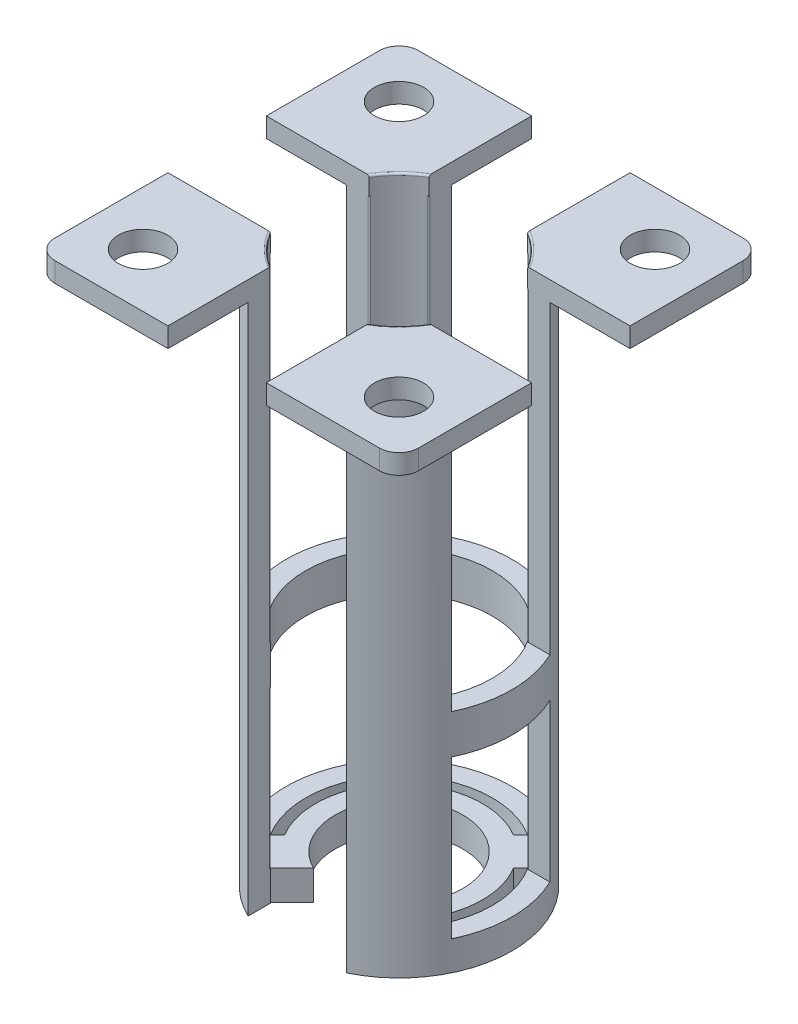
from build123d import *

# Parameters (mm, degrees)
SKETCH5_W           = 46.95000008
SKETCH5_H           = 46.95000008
SKETCH5_R           = 14.58500004
SKETCH5_R_2         = 12.04500004
BOSS_EXTRUDE2_DEPTH = 71.150000194
CUT_EXTRUDE2_REACH  = 83.054
CUT_EXTRUDE2_START  = -2.54
SKETCH5_5_W         = 46.95000008
SKETCH5_5_H         = 46.95000008
SKETCH5_5_R         = 14.58500004
SKETCH10_W          = 12.7
SKETCH10_H          = 68.610000194
CUT_EXTRUDE3_DEPTH  = 89.417762141
CIRPATTERN2_COUNT   = 2
CIRPATTERN2_ANGLE   = 90
CUT_EXTRUDE4_REACH  = 90.418
SKETCH12_W          = 12.7
SKETCH12_H          = 2.54
FILLET6_R           = 0.254
FILLET10_R          = 2.54
CUT_EXTRUDE5_REACH  = 78.22
SKETCH13_R          = 3.175
SKETCH23_R          = 14.58500004
SKETCH23_R_2        = 12.04500004
BOSS_EXTRUDE3_DEPTH = 3.81
BOSS_EXTRUDE4_DEPTH = 3.81
CUT_EXTRUDE7_DEPTH  = 76.078804586
BOSS_EXTRUDE6_DEPTH = 5.08
CIRPATTERN6_COUNT   = 4


with BuildPart() as part:
    # Sketch5 → Boss-Extrude2 (new body)
    # profile 1 of 2: a face of its own
    with BuildSketch(Plane(origin=(0, 0, 0), x_dir=(1, 0, 0), z_dir=(0, 1, 0))):
        Rectangle(SKETCH5_W, SKETCH5_H)
        Circle(SKETCH5_R, mode=Mode.SUBTRACT)
    # profile 2 of 2: a face of its own
    with BuildSketch(Plane(origin=(0, 0, 0), x_dir=(1, 0, 0), z_dir=(0, 1, 0))):
        Circle(SKETCH5_R)
        with Locations(Location((0, 0, 0), (0, 0, 270))):
            Circle(SKETCH5_R_2, mode=Mode.SUBTRACT)
    extrude(amount=-BOSS_EXTRUDE2_DEPTH)

    # Sketch5<5> → Cut-Extrude2 (cut, up to next)
    with BuildSketch(Plane(origin=(0, 0, 0), x_dir=(1, 0, 0), z_dir=(0, 1, 0)).offset(CUT_EXTRUDE2_START), mode=Mode.PRIVATE) as cut_extrude2_sk1:
        Rectangle(SKETCH5_5_W, SKETCH5_5_H)
        with Locations(Location((0, 0, 0), (0, 0, 270))):
            Circle(SKETCH5_5_R, mode=Mode.SUBTRACT)
    cut_extrude2_tool1 = extrude(cut_extrude2_sk1.sketch, amount=-CUT_EXTRUDE2_REACH, mode=Mode.PRIVATE) & part.part
    add(cut_extrude2_tool1.solids().sort_by_distance((0, -2.54, 22.811027))[0], mode=Mode.SUBTRACT)

    # Sketch10 → Cut-Extrude3 (cut, through all)
    with BuildSketch(Plane(origin=(23.47500004, 0, 0), x_dir=(0, 0, -1), z_dir=(1, 0, 0))):
        with Locations((0, -36.845000097)):
            Rectangle(SKETCH10_W, SKETCH10_H)
    cut_extrude3 = extrude(amount=-CUT_EXTRUDE3_DEPTH, mode=Mode.SUBTRACT)

    # CirPattern2: Cut-Extrude3 ×2 about axis
    cirpattern2_axis = Axis((0, 0, 0), (0, 1, 0))
    for i in range(1, CIRPATTERN2_COUNT):
        add(cut_extrude3.rotate(cirpattern2_axis, i * CIRPATTERN2_ANGLE / (CIRPATTERN2_COUNT - 1)), mode=Mode.SUBTRACT)

    # Sketch12 → Cut-Extrude4 (cut, up to next)
    with BuildSketch(Plane.XY.offset(23.47500004), mode=Mode.PRIVATE) as cut_extrude4_sk1:
        with Locations((0, -1.27)):
            Rectangle(SKETCH12_W, SKETCH12_H)
    cut_extrude4_tool1 = extrude(cut_extrude4_sk1.sketch, amount=-CUT_EXTRUDE4_REACH, mode=Mode.PRIVATE) & part.part
    cut_extrude4 = cut_extrude4_tool1.solids().sort_by_distance((0, -1.27, 23.475))[0]
    add(cut_extrude4, mode=Mode.SUBTRACT)

    # Fillet6
    fillet6_edges = [part.edges().sort_by_distance(p)[0] for p in [
        (8.517101208, -71.150000194, -8.517101208),
        (-8.517101208, -71.150000194, 8.517101208),
        (-12.04500004, -2.54, 0),
        (12.04500004, -2.54, 0),
        (-10.235210108, -36.845000097, -6.35),
        (10.235210108, -36.845000097, -6.35),
        (10.235210108, -36.845000097, 6.35),
        (-10.235210108, -36.845000097, 6.35),
        (0, 0, -12.04500004),
        (-8.517101208, -71.150000194, -8.517101208),
        (8.517101208, -71.150000194, 8.517101208),
        (0, -2.54, -12.04500004),
        (-6.35, -35.575000097, 10.235210108),
        (-6.35, -36.845000097, -10.235210108),
        (6.35, -36.845000097, -10.235210108),
        (6.35, -35.575000097, 10.235210108),
    ]]
    fillet(fillet6_edges, radius=FILLET6_R)

    # Fillet10
    fillet10_edges = [part.edges().sort_by_distance(p)[0] for p in [
        (23.47500004, -1.27, 23.47500004),
        (23.47500004, -1.27, -23.47500004),
        (-23.47500004, -1.27, -23.47500004),
        (-23.47500004, -1.27, 23.47500004),
    ]]
    fillet(fillet10_edges, radius=FILLET10_R)

    # Sketch13 → Cut-Extrude5 (cut, up to next)
    with BuildSketch(Plane.XZ.offset(2.54), mode=Mode.PRIVATE) as cut_extrude5_sk1:
        with Locations(Location((-16.522101848, 16.522101848, 0), (0, 0, 270))):
            Circle(SKETCH13_R)
    cut_extrude5_tool1 = extrude(cut_extrude5_sk1.sketch, amount=-CUT_EXTRUDE5_REACH, mode=Mode.PRIVATE) & part.part
    # Sketch13 → Cut-Extrude5 (cut, up to next)
    with BuildSketch(Plane.XZ.offset(2.54), mode=Mode.PRIVATE) as cut_extrude5_sk2:
        with Locations(Location((16.522101848, 16.522101848, 0), (0, 0, 90))):
            Circle(SKETCH13_R)
    cut_extrude5_tool2 = extrude(cut_extrude5_sk2.sketch, amount=-CUT_EXTRUDE5_REACH, mode=Mode.PRIVATE) & part.part
    # Sketch13 → Cut-Extrude5 (cut, up to next)
    with BuildSketch(Plane.XZ.offset(2.54), mode=Mode.PRIVATE) as cut_extrude5_sk3:
        with Locations(Location((16.522101848, -16.522101848, 0), (0, 0, 270))):
            Circle(SKETCH13_R)
    cut_extrude5_tool3 = extrude(cut_extrude5_sk3.sketch, amount=-CUT_EXTRUDE5_REACH, mode=Mode.PRIVATE) & part.part
    # Sketch13 → Cut-Extrude5 (cut, up to next)
    with BuildSketch(Plane.XZ.offset(2.54), mode=Mode.PRIVATE) as cut_extrude5_sk4:
        with Locations(Location((-16.522101848, -16.522101848, 0), (0, 0, 90))):
            Circle(SKETCH13_R)
    cut_extrude5_tool4 = extrude(cut_extrude5_sk4.sketch, amount=-CUT_EXTRUDE5_REACH, mode=Mode.PRIVATE) & part.part
    add(cut_extrude5_tool1.solids().sort_by_distance((-16.522102, -2.54, 16.522102))[0], mode=Mode.SUBTRACT)
    add(cut_extrude5_tool2.solids().sort_by_distance((16.522102, -2.54, 16.522102))[0], mode=Mode.SUBTRACT)
    add(cut_extrude5_tool3.solids().sort_by_distance((16.522102, -2.54, -16.522102))[0], mode=Mode.SUBTRACT)
    add(cut_extrude5_tool4.solids().sort_by_distance((-16.522102, -2.54, -16.522102))[0], mode=Mode.SUBTRACT)

    # Sketch23 → Boss-Extrude3 (add)
    with BuildSketch(Plane(origin=(0, -67.340000194, 0), x_dir=(-1, 0, 0), z_dir=(0, -1, 0))):
        with Locations(Location((0, 0, 0), (0, 0, 270))):
            Circle(SKETCH23_R)
        with Locations(Location((0, 0, 0), (0, 0, 270))):
            Circle(SKETCH23_R_2, mode=Mode.SUBTRACT)
    extrude(amount=BOSS_EXTRUDE3_DEPTH)

    # Sketch26 → Boss-Extrude4 (add)
    with BuildSketch(Plane(origin=(0, -67.340000194, 0), x_dir=(-1, 0, 0), z_dir=(0, -1, 0))):
        with BuildLine():
            Line((-5.545009846, 9.238695345), (-6.467613628, 10.161299126))
            ThreePointArc((-6.467613628, 10.161299126), (-8.517101208, 8.517101208), (-10.161299126, 6.467613628))
            Line((-10.161299126, 6.467613628), (-9.238695345, 5.545009846))
            ThreePointArc((-9.238695345, 5.545009846), (-7.619075596, 7.619075596), (-5.545009846, 9.238695345))
        make_face()
        with BuildLine():
            ThreePointArc((6.467613628, -10.161299126), (8.517101208, -8.517101208), (10.161299126, -6.467613628))
            Line((10.161299126, -6.467613628), (9.238695345, -5.545009846))
            ThreePointArc((9.238695345, -5.545009846), (7.619075596, -7.619075596), (5.545009846, -9.238695345))
            Line((5.545009846, -9.238695345), (6.467613628, -10.161299126))
        make_face()
        with BuildLine():
            ThreePointArc((10.161299126, 6.467613628), (8.517101208, 8.517101208), (6.467613628, 10.161299126))
            Line((6.467613628, 10.161299126), (5.545009846, 9.238695345))
            ThreePointArc((5.545009846, 9.238695345), (7.619075596, 7.619075596), (9.238695345, 5.545009846))
            Line((9.238695345, 5.545009846), (10.161299126, 6.467613628))
        make_face()
        with BuildLine():
            Line((-9.238695345, -5.545009846), (-10.161299126, -6.467613628))
            ThreePointArc((-10.161299126, -6.467613628), (-8.517101208, -8.517101208), (-6.467613628, -10.161299126))
            Line((-6.467613628, -10.161299126), (-5.545009846, -9.238695345))
            ThreePointArc((-5.545009846, -9.238695345), (-7.619075596, -7.619075596), (-9.238695345, -5.545009846))
        make_face()
        with BuildLine():
            Line((-3.675546651, 7.36923215), (-5.545009846, 9.238695345))
            ThreePointArc((-5.545009846, 9.238695345), (-7.619075596, 7.619075596), (-9.238695345, 5.545009846))
            Line((-9.238695345, 5.545009846), (-7.36923215, 3.675546651))
            ThreePointArc((-7.36923215, 3.675546651), (-5.823024371, 5.823024371), (-3.675546651, 7.36923215))
        make_face()
        with BuildLine():
            Line((9.238695345, -5.545009846), (7.36923215, -3.675546651))
            ThreePointArc((7.36923215, -3.675546651), (5.823024371, -5.823024371), (3.675546651, -7.36923215))
            Line((3.675546651, -7.36923215), (5.545009846, -9.238695345))
            ThreePointArc((5.545009846, -9.238695345), (7.619075596, -7.619075596), (9.238695345, -5.545009846))
        make_face()
        with BuildLine():
            ThreePointArc((9.238695345, 5.545009846), (7.619075596, 7.619075596), (5.545009846, 9.238695345))
            Line((5.545009846, 9.238695345), (3.675546651, 7.36923215))
            ThreePointArc((3.675546651, 7.36923215), (5.823024371, 5.823024371), (7.36923215, 3.675546651))
            Line((7.36923215, 3.675546651), (9.238695345, 5.545009846))
        make_face()
        with BuildLine():
            Line((-7.36923215, -3.675546651), (-9.238695345, -5.545009846))
            ThreePointArc((-9.238695345, -5.545009846), (-7.619075596, -7.619075596), (-5.545009846, -9.238695345))
            Line((-5.545009846, -9.238695345), (-3.675546651, -7.36923215))
            ThreePointArc((-3.675546651, -7.36923215), (-5.823024371, -5.823024371), (-7.36923215, -3.675546651))
        make_face()
        with BuildLine():
            Line((-7.36923215, 3.675546651), (-9.238695345, 5.545009846))
            ThreePointArc((-9.238695345, 5.545009846), (-10.77500004, 0), (-9.238695345, -5.545009846))
            Line((-9.238695345, -5.545009846), (-7.36923215, -3.675546651))
            ThreePointArc((-7.36923215, -3.675546651), (-8.23500004, 0), (-7.36923215, 3.675546651))
        make_face()
        with BuildLine():
            ThreePointArc((5.545009846, 9.238695345), (0, 10.77500004), (-5.545009846, 9.238695345))
            Line((-5.545009846, 9.238695345), (-3.675546651, 7.36923215))
            ThreePointArc((-3.675546651, 7.36923215), (0, 8.23500004), (3.675546651, 7.36923215))
            Line((3.675546651, 7.36923215), (5.545009846, 9.238695345))
        make_face()
        with BuildLine():
            ThreePointArc((10.77500004, 0), (10.383823202, 2.876950048), (9.238695345, 5.545009846))
            Line((9.238695345, 5.545009846), (7.36923215, 3.675546651))
            ThreePointArc((7.36923215, 3.675546651), (8.015636366, 1.888067612), (8.23500004, 0))
            ThreePointArc((8.23500004, 0), (8.015636366, -1.888067612), (7.36923215, -3.675546651))
            Line((7.36923215, -3.675546651), (9.238695345, -5.545009846))
            ThreePointArc((9.238695345, -5.545009846), (10.383823202, -2.876950048), (10.77500004, 0))
        make_face()
    extrude(amount=BOSS_EXTRUDE4_DEPTH)

    # Sketch31 → Cut-Extrude7 (cut, through all)
    with BuildSketch(Plane(origin=(0, -67.340000194, 0), x_dir=(1, 0, 0), z_dir=(0, 1, 0))):
        with BuildLine():
            Line((-6.35, -10.375576417), (-6.35, -13.130107622))
            ThreePointArc((-6.35, -13.130107622), (0, -14.58500004), (6.35, -13.130107622))
            Line((6.35, -13.130107622), (6.35, -10.375576417))
            Line((6.35, -10.375576417), (6.35, -10.235210108))
            ThreePointArc((6.35, -10.235210108), (0, -12.04500004), (-6.35, -10.235210108))
            Line((-6.35, -10.235210108), (-6.35, -10.375576417))
        make_face()
    extrude(amount=-CUT_EXTRUDE7_DEPTH, mode=Mode.SUBTRACT)

    # Sketch32 → Boss-Extrude6 (add)
    with BuildSketch(Plane(origin=(0, -41.940000194, 0), x_dir=(-1, 0, 0), z_dir=(0, -1, 0))):
        with BuildLine():
            Line((-6.35, -13.130107622), (-6.35, -10.235210108))
            ThreePointArc((-6.35, -10.235210108), (0, 12.04500004), (6.35, -10.235210108))
            Line((6.35, -10.235210108), (6.35, -13.130107622))
            ThreePointArc((6.35, -13.130107622), (0, 14.58500004), (-6.35, -13.130107622))
        make_face()
    extrude(amount=BOSS_EXTRUDE6_DEPTH)

    # CirPattern6: Cut-Extrude4 ×4 about axis
    cirpattern6_axis = Axis((0, 0, 0), (0, 1, 0))
    for i in range(1, CIRPATTERN6_COUNT):
        add(cut_extrude4.rotate(cirpattern6_axis, i * 360 / CIRPATTERN6_COUNT), mode=Mode.SUBTRACT)


solid = part.part
